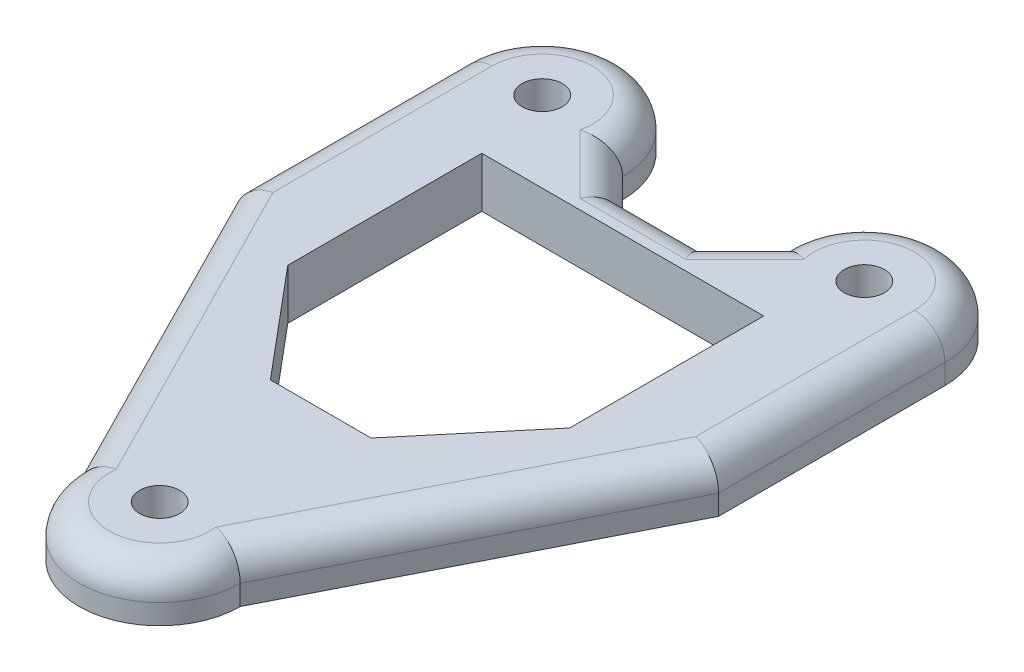
from build123d import *

# Parameters (mm, degrees)
SKETCH1_R           = 2
BOSS_EXTRUDE1_DEPTH = 5
FILLET2_R           = 3


with BuildPart() as part:
    # Sketch1 → Boss-Extrude1 (new body)
    with BuildSketch(Plane(origin=(0, 0, 0), x_dir=(1, 0, 0), z_dir=(0, 1, 0))):
        with BuildLine():
            Line((12.081978252, 23.920233872), (28.081978252, -7.602676631))
            ThreePointArc((28.081978252, -7.602676631), (36.081978252, -15.602676631), (44.081978252, -7.602676631))
            Line((44.081978252, -7.602676631), (60.081978252, 23.920233872))
            Line((60.081978252, 23.920233872), (60.081978252, 39.133054542))
            Line((60.081978252, 39.133054542), (60.081978252, 42.765188956))
            Line((60.081978252, 42.765188956), (60.081978252, 46.397323369))
            ThreePointArc((60.081978252, 46.397323369), (52.081978252, 54.397323369), (44.081978252, 46.397323369))
            Line((44.081978252, 46.397323369), (40.081978252, 42.397323369))
            Line((40.081978252, 42.397323369), (32.081978252, 42.397323369))
            Line((32.081978252, 42.397323369), (28.081978252, 46.397323369))
            ThreePointArc((28.081978252, 46.397323369), (20.081978252, 54.397323369), (12.081978252, 46.397323369))
            Line((12.081978252, 46.397323369), (12.081978252, 39.746064801))
            Line((12.081978252, 39.746064801), (12.081978252, 23.920233872))
        make_face()
        with Locations(Location((36.081978252, -7.602676631, 0), (0, 0, 270))):
            Circle(SKETCH1_R, mode=Mode.SUBTRACT)
        Polygon((22.081978252, 19.123105702), (22.081978252, 38.397323369), (50.081978252, 38.397323369), (50.081978252, 19.123105702), (41.081978252, 8.397323369), (36.081978252, 8.397323369), (31.081978252, 8.397323369), align=None, mode=Mode.SUBTRACT)
        with Locations(Location((20.081978252, 46.397323369, 0), (0, 0, 270))):
            Circle(SKETCH1_R, mode=Mode.SUBTRACT)
        with Locations(Location((52.081978252, 46.397323369, 0), (0, 0, 270))):
            Circle(SKETCH1_R, mode=Mode.SUBTRACT)
    extrude(amount=BOSS_EXTRUDE1_DEPTH)

    # Fillet2
    fillet2_edges = [part.edges().sort_by_distance(p)[0] for p in [
        (12.081978252, 5, -35.158778621),
        (20.081978252, 5, -8.158778621),
        (36.081978252, 5, 15.602676631),
        (52.081978252, 5, -8.158778621),
        (60.081978252, 5, -35.158778621),
        (52.081978252, 5, -54.397323369),
        (42.081978252, 5, -44.397323369),
        (36.081978252, 5, -42.397323369),
        (30.081978252, 5, -44.397323369),
        (20.081978252, 5, -54.397323369),
    ]]
    fillet(fillet2_edges, radius=FILLET2_R)


solid = part.part
